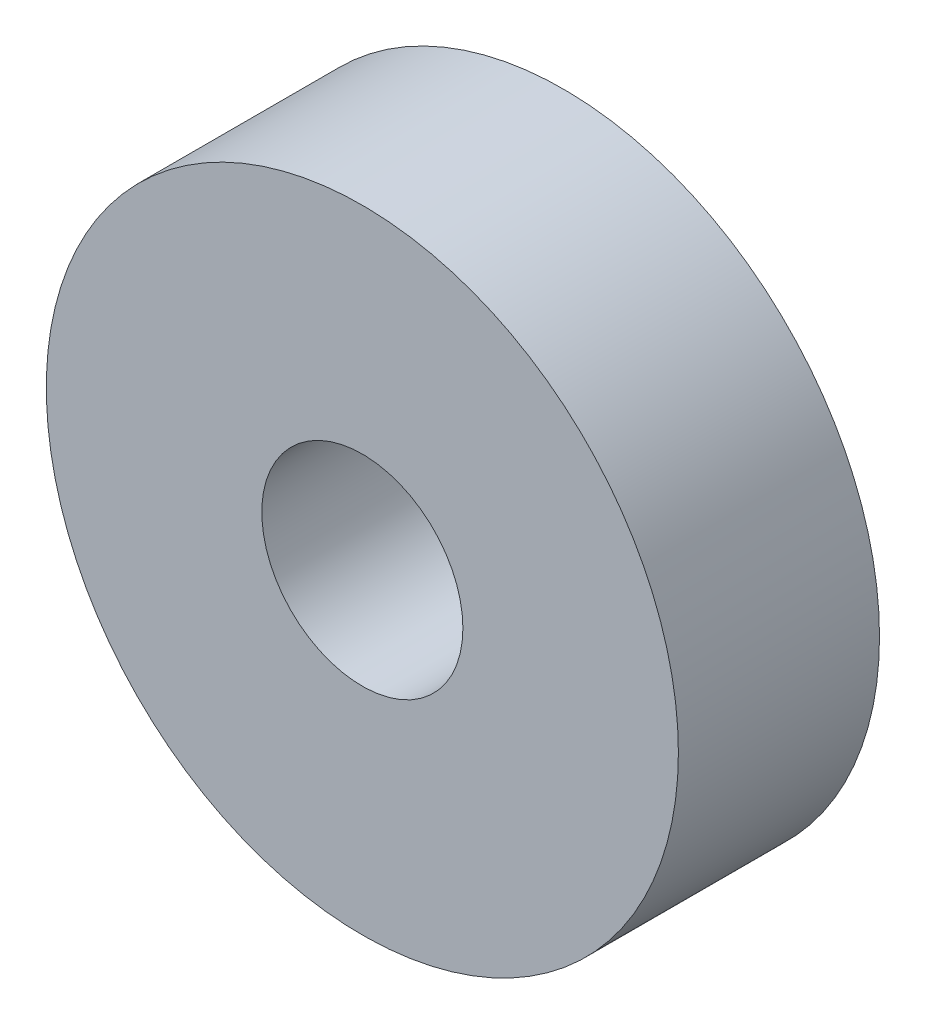
from build123d import *

# Parameters (mm, degrees)
F_0323_CYLINDER_SKETCH_R = 11
F_0323_CYLINDER_DEPTH    = 7
F_0324_CYLINDER_SKETCH_R = 3.5
F_0324_CYLINDER_DEPTH    = 8


with BuildPart() as part:
    # 0323_cylinder_Sketch → 0323_cylinder (new body)
    with BuildSketch(Plane.XY):
        Circle(F_0323_CYLINDER_SKETCH_R)
    extrude(amount=F_0323_CYLINDER_DEPTH)


with BuildPart() as part_1:
    # 0323_cylinder_Translate: moved
    add(part.part.moved(Location((0, 0, -3.5))))


with BuildPart() as body_2:
    # 0324_cylinder_Sketch → 0324_cylinder (new body)
    with BuildSketch(Plane.XY):
        Circle(F_0324_CYLINDER_SKETCH_R)
    extrude(amount=F_0324_CYLINDER_DEPTH)


with BuildPart() as body_2_1:
    # 0324_cylinder_Translate: moved
    add(body_2.part.moved(Location((0, 0, -4))))


with BuildPart() as part_2:
    add(part_1.part)

    # 0325_sub: cut body 2
    add(body_2_1.part, mode=Mode.SUBTRACT)


solid = part_2.part
